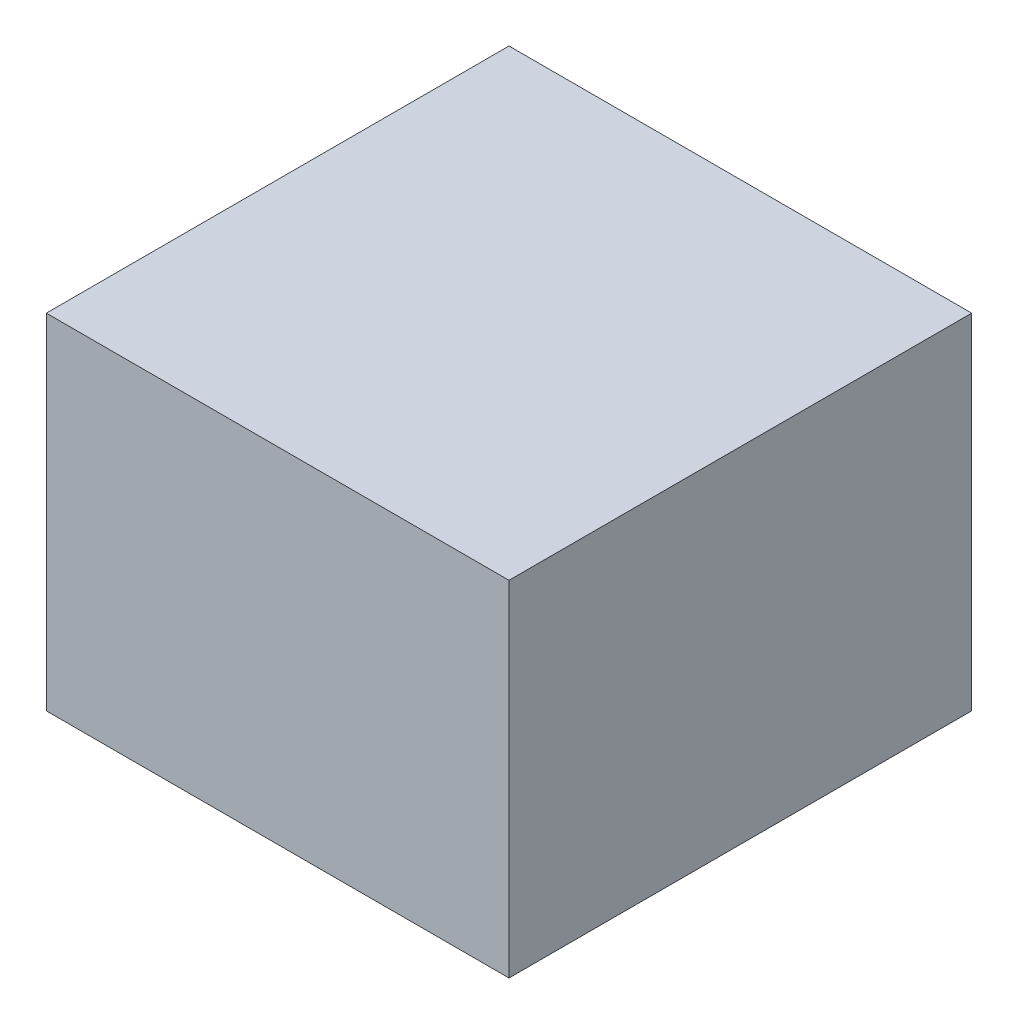
from build123d import *

# Parameters (mm, degrees)
SKETCH1_W           = 45
SKETCH1_H           = 45
BOSS_EXTRUDE1_DEPTH = 33.5


with BuildPart() as part:
    # Sketch1 → Boss-Extrude1 (new body)
    with BuildSketch(Plane(origin=(0, 0, 0), x_dir=(1, 0, 0), z_dir=(0, 1, 0))):
        with Locations((22.5, 22.5)):
            Rectangle(SKETCH1_W, SKETCH1_H)
    extrude(amount=BOSS_EXTRUDE1_DEPTH)


solid = part.part
